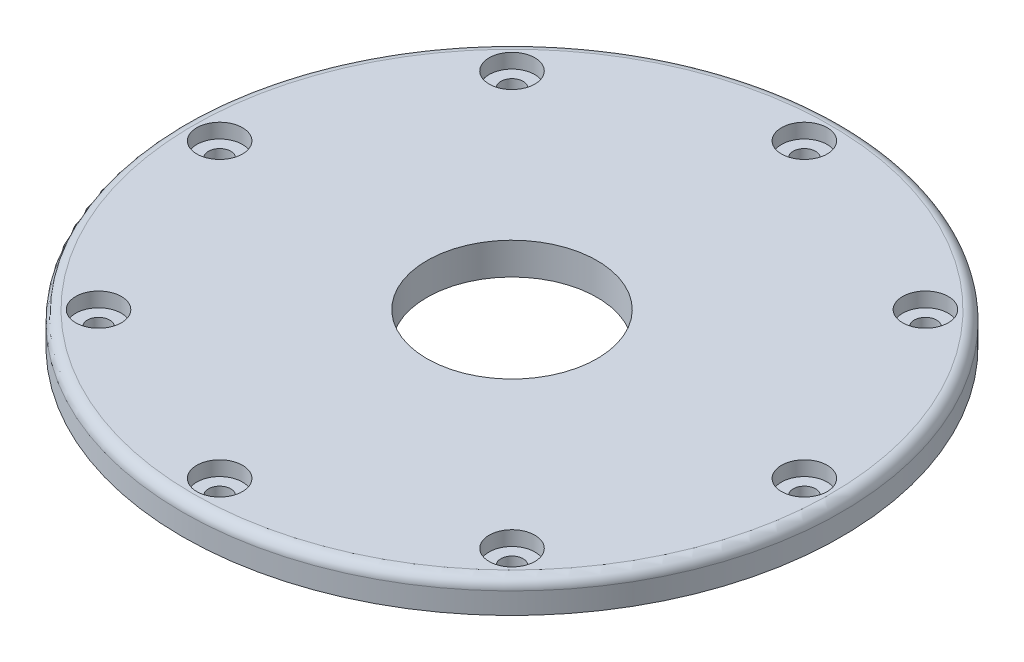
from build123d import *

# Parameters (mm, degrees)
SKETCH1_R                                = 155
BOSS_EXTRUDE1_DEPTH                      = 15
CBORE_FOR_M10_HEX_HEAD_BOLT1_D           = 10.5
CBORE_FOR_M10_HEX_HEAD_BOLT1_CBORE_D     = 21.48
CBORE_FOR_M10_HEX_HEAD_BOLT1_CBORE_DEPTH = 6.85
CIRPATTERN1_COUNT                        = 8
SKETCH2_R                                = 40
CUT_EXTRUDE1_DEPTH                       = 15
FILLET1_R                                = 5


with BuildPart() as part:
    # Sketch1 → Boss-Extrude1 (new body)
    with BuildSketch(Plane(origin=(0, 0, 0), x_dir=(1, 0, 0), z_dir=(0, 1, 0))):
        with Locations(Location((0, 0, 0), (0, 0, 270))):
            Circle(SKETCH1_R)
    extrude(amount=BOSS_EXTRUDE1_DEPTH)

    # CBORE for M10 Hex Head Bolt1 (through all)
    with Locations(Plane(origin=(0, 15, -137.5), x_dir=(0, 0, 1), z_dir=(0, 1, 0))):
        with Locations((0, 0)):
            cbore_for_m10_hex_head_bolt1 = CounterBoreHole(CBORE_FOR_M10_HEX_HEAD_BOLT1_D / 2, CBORE_FOR_M10_HEX_HEAD_BOLT1_CBORE_D / 2, CBORE_FOR_M10_HEX_HEAD_BOLT1_CBORE_DEPTH)

    # CirPattern1: CBORE for M10 Hex Head Bolt1 ×8 about axis
    cirpattern1_axis = Axis((0, 0, 0), (0, 1, 0))
    for i in range(1, CIRPATTERN1_COUNT):
        add(cbore_for_m10_hex_head_bolt1.rotate(cirpattern1_axis, i * 360 / CIRPATTERN1_COUNT), mode=Mode.SUBTRACT)

    # Sketch2 → Cut-Extrude1 (cut)
    with BuildSketch(Plane(origin=(0, 15, 0), x_dir=(1, 0, 0), z_dir=(0, 1, 0))):
        with Locations(Location((0, 0, 0), (0, 0, 270))):
            Circle(SKETCH2_R)
    extrude(amount=-CUT_EXTRUDE1_DEPTH, mode=Mode.SUBTRACT)

    # Fillet1
    fillet1_edges = [part.edges().sort_by_distance(p)[0] for p in [
        (0, 15, -155),
    ]]
    fillet(fillet1_edges, radius=FILLET1_R)


solid = part.part
